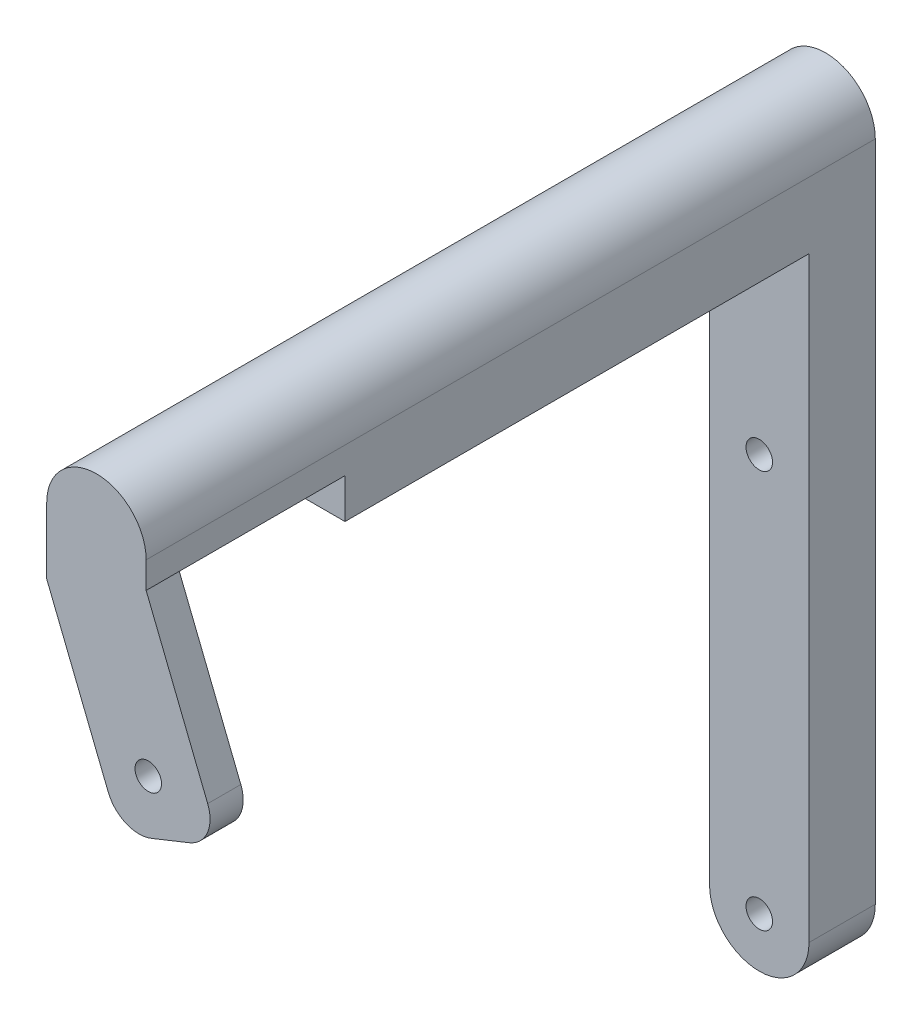
from build123d import *

# Parameters (mm, degrees)
ESQUISSE1_R             = 15
ESQUISSE1_R_2           = 4
BOSS_EXTRU_1_DEPTH      = 20
BOSS_EXTRU_2_DEPTH      = 200
ENL_V_MAT_EXTRU_2_DEPTH = 60
ESQUISSE3_W             = 32.310988843
ESQUISSE3_H             = 10
BOSS_EXTRU_3_DEPTH      = 60
CONG_2_R                = 10
ENL_V_MAT_EXTRU_1_REACH = 311.516
ESQUISSE4_R             = 4


with BuildPart() as part:
    # Esquisse1 → Boss.-Extru.1 (new body)
    # profile 1 of 5: a face of its own
    with BuildSketch(Plane.XY):
        Circle(ESQUISSE1_R)
        Circle(ESQUISSE1_R_2, mode=Mode.SUBTRACT)
    # profile 2 of 5: a face of its own
    with BuildSketch(Plane.XY):
        with Locations((0, -80)):
            Circle(ESQUISSE1_R)
        with Locations((0, -80)):
            Circle(ESQUISSE1_R_2, mode=Mode.SUBTRACT)
    # profile 3 of 5: a face of its own
    with BuildSketch(Plane.XY):
        with BuildLine():
            ThreePointArc((15, 0), (0, -15), (-15, 0))
            Line((-15, 0), (-15, -80.000000008))
            ThreePointArc((-15, -80.000000008), (-4e-09, -65), (15, -80))
            Line((15, -80), (15, 0))
        make_face()
    # profile 4 of 5: a face of its own
    with BuildSketch(Plane.XY):
        with BuildLine():
            ThreePointArc((15, -80), (4e-09, -95), (-15, -80.000000008))
            Line((-15, -80.000000008), (-15, -200))
            ThreePointArc((-15, -200), (0, -185), (15, -200))
            Line((15, -200), (15, -80))
        make_face()
    # profile 5 of 5: a face of its own
    with BuildSketch(Plane.XY):
        with Locations((0, -200)):
            Circle(ESQUISSE1_R)
        with Locations((0, -200)):
            Circle(ESQUISSE1_R_2, mode=Mode.SUBTRACT)
    extrude(amount=BOSS_EXTRU_1_DEPTH)

    # Esquisse2 → Boss.-Extru.2 (add)
    with BuildSketch(Plane.XY.offset(20)):
        with BuildLine():
            Line((-15, 0), (-15, -20))
            Line((-15, -20), (15, -20))
            Line((15, -20), (15, 0))
            ThreePointArc((15, 0), (0, 15), (-15, 0))
        make_face()
    extrude(amount=BOSS_EXTRU_2_DEPTH)

    # Esquisse5 → Enlèv. mat.-Extru.2 (cut)
    with BuildSketch(Plane.XY.offset(220)):
        Polygon((-15, -20), (15, -8), (15, -20), align=None)
    extrude(amount=-ENL_V_MAT_EXTRU_2_DEPTH, mode=Mode.SUBTRACT)

    # Esquisse3 → Boss.-Extru.3 (add)
    with BuildSketch(Plane(origin=(-1.072849637, -14.429139855, 0), x_dir=(0.9284766908852593, 0.3713906763541038, 0), z_dir=(0.3713906763541038, -0.9284766908852594, 0))):
        with Locations((1.155494421, 215)):
            Rectangle(ESQUISSE3_W, ESQUISSE3_H)
    extrude(amount=BOSS_EXTRU_3_DEPTH)

    # Congé2
    cong_2_edges = [part.edges().sort_by_distance(p)[0] for p in [
        (7.283440581, -75.708601453, 215),
        (37.283440581, -63.708601453, 215),
    ]]
    fillet(cong_2_edges, radius=CONG_2_R)

    # Esquisse4 → Enlèv. mat.-Extru.1 (cut, up to next)
    with BuildSketch(Plane.XY.offset(220), mode=Mode.PRIVATE) as enl_v_mat_extru_1_sk1:
        with Locations((15.639730799, -56.210590945)):
            Circle(ESQUISSE4_R)
    enl_v_mat_extru_1_tool1 = extrude(enl_v_mat_extru_1_sk1.sketch, amount=-ENL_V_MAT_EXTRU_1_REACH, mode=Mode.PRIVATE) & part.part
    add(enl_v_mat_extru_1_tool1.solids().sort_by_distance((15.639731, -56.210591, 220))[0], mode=Mode.SUBTRACT)


solid = part.part
